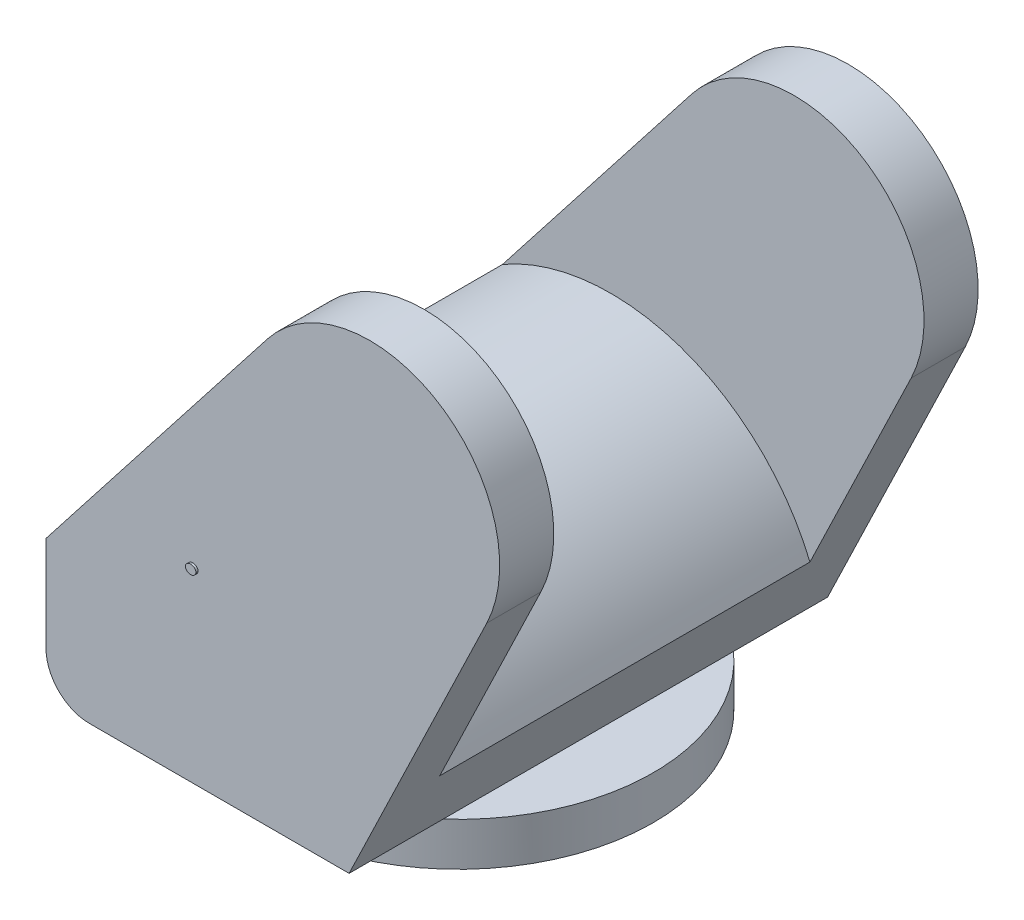
from build123d import *

# Parameters (mm, degrees)
BOSS_EXTRUDE1_DEPTH      = 110.5
BOSS_EXTRUDE1_DEPTH_BACK = 110.5
CUT_EXTRUDE1_DEPTH       = 85.5
CUT_EXTRUDE1_DEPTH_BACK  = 85.5
SKETCH3_R                = 90
BOSS_EXTRUDE2_DEPTH      = 20
BODY_MOVE_COPY1_ANGLE    = 90
BOSS_EXTRUDE3_DEPTH      = 1


with BuildPart() as part:
    # Sketch1 → Boss-Extrude1 (new, two sides: drawn at the far end of the back side and taken through both)
    with BuildSketch(Plane(origin=(0, 0, 0), x_dir=(0, 0, -1), z_dir=(1, 0, 0)).offset(-BOSS_EXTRUDE1_DEPTH_BACK)):
        with BuildLine():
            Line((-64.292863754, -51.10932545), (55.707136246, -51.10932545))
            ThreePointArc((55.707136246, -51.10932545), (69.84927187, -45.251461074), (75.707136246, -31.10932545))
            Line((75.707136246, -31.10932545), (75.707136246, 12.89067455))
            Line((75.707136246, 12.89067455), (-26.557571018, 143.789344322))
            ThreePointArc((-26.557571018, 143.789344322), (-105.517875867, 157.806043193), (-127.885671837, 80.793840961))
            Line((-127.885671837, 80.793840961), (-64.292863754, -51.10932545))
        make_face()
    extrude(amount=BOSS_EXTRUDE1_DEPTH + BOSS_EXTRUDE1_DEPTH_BACK)

    # Sketch2 → Cut-Extrude1 (cut, two sides: drawn at the far end of the back side and taken through both)
    with BuildSketch(Plane(origin=(0, 0, 0), x_dir=(0, 0, -1), z_dir=(1, 0, 0)).offset(-CUT_EXTRUDE1_DEPTH_BACK)):
        with BuildLine():
            Line((-127.885671837, 80.793840961), (-81.149808611, -16.144925076))
            ThreePointArc((-81.149808611, -16.144925076), (-21.055510127, 40.123069763), (60.857619094, 31.898033921))
            Line((60.857619094, 31.898033921), (-26.557571018, 143.789344322))
            ThreePointArc((-26.557571018, 143.789344322), (-105.517875867, 157.806043193), (-127.885671837, 80.793840961))
        make_face()
    extrude(amount=CUT_EXTRUDE1_DEPTH + CUT_EXTRUDE1_DEPTH_BACK, mode=Mode.SUBTRACT)

    # Sketch3 → Boss-Extrude2 (add)
    with BuildSketch(Plane.XZ.offset(51.10932545)):
        with Locations((0, 4.292863754)):
            Circle(SKETCH3_R)
    extrude(amount=BOSS_EXTRUDE2_DEPTH)


with BuildPart() as part_1:
    # Body-Move/Copy1: moved
    add(part.part.rotate(Axis((0, 0, 0), (0, 1, 0)), BODY_MOVE_COPY1_ANGLE))

    # Sketch4 → Boss-Extrude3 (add)
    with BuildSketch(Plane.XY.offset(110.5)):
        with BuildLine():
            add(Edge.make_bspline(
                [(-7.892298412, 36.986704623), (-7.731424988, 36.97864928), (-7.419070809, 36.963008908), (-6.967618916, 36.851284273), (-6.555873051, 36.656661621), (-6.188786467, 36.392582396), (-5.87896222, 36.078180341), (-5.65016273, 35.71921506), (-5.513989502, 35.321796415), (-5.497073858, 35.044635312), (-5.488452259, 34.90337129)],
                knots=[0, 0, 0, 0, 1.093025379, 2.122233962, 3.13739964, 4.170167025, 5.181202767, 6.119320369, 7.041451468, 8, 8, 8, 8], degree=3))
            add(Edge.make_bspline(
                [(-5.488452259, 34.90337129), (-5.497406625, 34.765509384), (-5.515182791, 34.491826572), (-5.649926135, 34.097337276), (-5.880505469, 33.738380755), (-6.18693796, 33.41913881), (-6.555993835, 33.154861618), (-6.968359777, 32.961898769), (-7.418241254, 32.842085164), (-7.731283731, 32.827526345), (-7.892298412, 32.820037956)],
                knots=[0, 0, 0, 0, 0.937343707, 1.860810353, 2.800286657, 3.820978539, 4.855241709, 5.871877678, 6.905391563, 8, 8, 8, 8], degree=3))
            add(Edge.make_bspline(
                [(-7.892298412, 32.820037956), (-8.053339268, 32.827461421), (-8.366432635, 32.841894016), (-8.817422774, 32.963004322), (-9.232383344, 33.153609982), (-9.602694964, 33.417641247), (-9.90389839, 33.740107583), (-10.134877578, 34.097146255), (-10.26936178, 34.491874817), (-10.287172696, 34.765525545), (-10.296144566, 34.90337129)],
                knots=[0, 0, 0, 0, 1.094267983, 2.127460414, 3.154075327, 4.188016812, 5.200584313, 6.139768412, 7.062947834, 8, 8, 8, 8], degree=3))
            add(Edge.make_bspline(
                [(-10.296144566, 34.90337129), (-10.287504989, 35.044618426), (-10.27055407, 35.321746398), (-10.134639162, 35.71940767), (-9.905453118, 36.07643862), (-9.600833421, 36.394095039), (-9.23250791, 36.657911588), (-8.818168555, 36.850199857), (-8.365603653, 36.963201799), (-8.053198229, 36.978714853), (-7.892298412, 36.986704623)],
                knots=[0, 0, 0, 0, 0.95825844, 1.880110469, 2.817944164, 3.820814674, 4.853269506, 5.878408302, 6.90730541, 8, 8, 8, 8], degree=3))
        make_face()
    extrude(amount=BOSS_EXTRUDE3_DEPTH)


with BuildPart() as part_2:
    # Body-Move/Copy2: moved
    add(part_1.part.moved(Location((-73.839012149, -106.85067455, 0))))


solid = part_2.part
